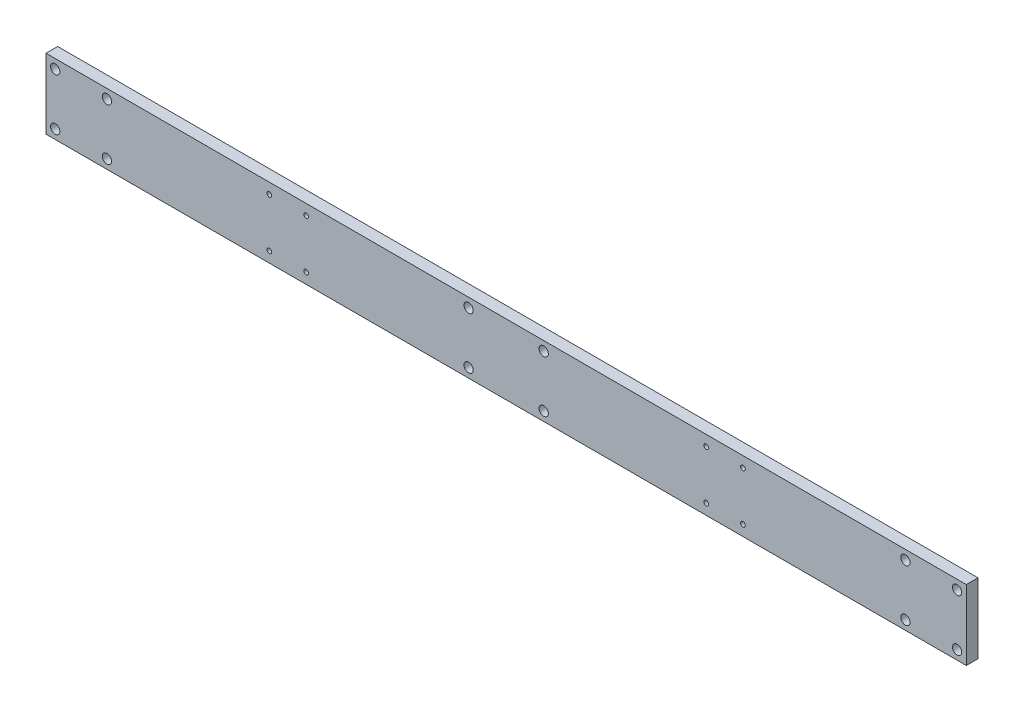
from build123d import *

# Parameters (mm, degrees)
CROQUIS1_W                    = 1000
CROQUIS1_H                    = 76.2
SALIENTE_EXTRUIR1_DEPTH       = 6.35
TALADRO_DE_MARGEN_PARA_3_81_D = 10.0838
F_10_CLEARANCE_HOLE1_D        = 5.1054


with BuildPart() as part:
    # Croquis1 → Saliente-Extruir1 (new, symmetric)
    with BuildSketch(Plane.XY):
        Rectangle(CROQUIS1_W, CROQUIS1_H)
    extrude(amount=SALIENTE_EXTRUIR1_DEPTH, both=True)

    # Taladro de margen para 3/81 (through all)
    with Locations(Plane(origin=(0, 0, -6.35), x_dir=(-1, 0, 0), z_dir=(0, 0, -1))):
        with Locations((433.800006232, 28.100007642), (490.000006232, 28.100007642), (490.000006232, -28.100007642), (433.800006232, -28.100007642), (-433.800006232, -28.100007642), (-490.000006232, -28.100007642), (-490.000006232, 28.100007642), (-433.800006232, 28.100007642), (40.799999964, 28.099999988), (40.799999964, -28.099999988), (-40.799999964, 28.099999988), (-40.799999964, -28.099999988)):
            Hole(TALADRO_DE_MARGEN_PARA_3_81_D / 2)

    # #10 Clearance Hole1 (through all)
    with Locations(Plane(origin=(0, 0, -6.35), x_dir=(-1, 0, 0), z_dir=(0, 0, -1))):
        with Locations((217.300003098, 26.5), (257.300003098, 26.5), (257.300003098, -26.5), (217.300003098, -26.5), (-257.300003098, 26.5), (-257.300003098, -26.5), (-217.300003098, -26.5), (-217.300003098, 26.5)):
            Hole(F_10_CLEARANCE_HOLE1_D / 2)


solid = part.part
